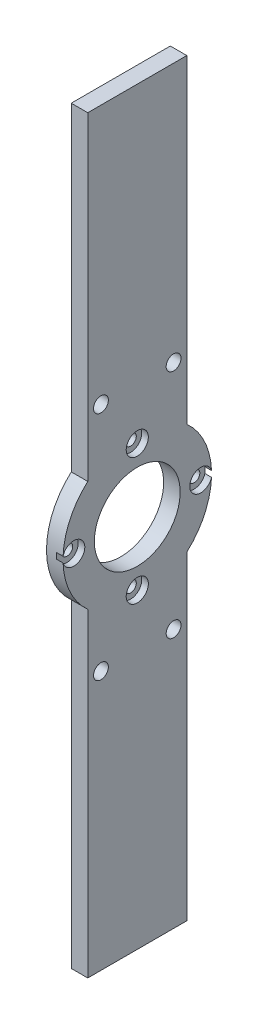
from build123d import *

# Parameters (mm, degrees)
SKETCH_1_W                  = 5
SKETCH_1_H                  = 30
EXTRUDE_1_DEPTH             = 227
SKETCH_2_R                  = 22.5
EXTRUDE_2_DEPTH             = 5
SKETCH_3_R                  = 13
CUT_EXTRUDE_1_DEPTH         = 231.130940988
HOLE_WIZARD_M31_D           = 3.4
HOLE_WIZARD_M31_CBORE_D     = 6.7
HOLE_WIZARD_M31_CBORE_DEPTH = 2
HOLE_WIZARD_M41_D           = 4.5


with BuildPart() as part:
    # Эскиз1 → Бобышка-Вытянуть1 (new body)
    with BuildSketch(Plane(origin=(0, 0, 0), x_dir=(1, 0, 0), z_dir=(0, 1, 0))):
        with Locations((2.5, -15)):
            Rectangle(SKETCH_1_W, SKETCH_1_H)
    extrude(amount=EXTRUDE_1_DEPTH)

    # Эскиз2 → Бобышка-Вытянуть2 (add)
    with BuildSketch(Plane.ZY):
        with Locations((15, 113.5)):
            Circle(SKETCH_2_R)
    extrude(amount=-EXTRUDE_2_DEPTH)

    # Эскиз3 → Вырез-Вытянуть1 (cut, through all)
    with BuildSketch(Plane.ZY):
        with Locations((15, 113.5)):
            Circle(SKETCH_3_R)
    extrude(amount=-CUT_EXTRUDE_1_DEPTH, mode=Mode.SUBTRACT)

    # Цековка для  винта с полукруглой головкой M31 (through all)
    with Locations(Plane(origin=(5, -25.024735225, 7.262908886), x_dir=(0, 0, 1), z_dir=(1, 0, 0))):
        with Locations((7.737091114, -157.774735225), (-11.512908886, -138.524735225), (7.737091114, -119.274735225), (26.987091114, -138.524735225)):
            CounterBoreHole(HOLE_WIZARD_M31_D / 2, HOLE_WIZARD_M31_CBORE_D / 2, HOLE_WIZARD_M31_CBORE_DEPTH)

    # Отверстие с зазором M41 (through all)
    with Locations(Plane(origin=(5, 0, 0), x_dir=(0, 0, -1), z_dir=(1, 0, 0))):
        with Locations((-26, 148.5), (-4, 148.5), (-4, 78.5), (-26, 78.5)):
            Hole(HOLE_WIZARD_M41_D / 2)


solid = part.part
